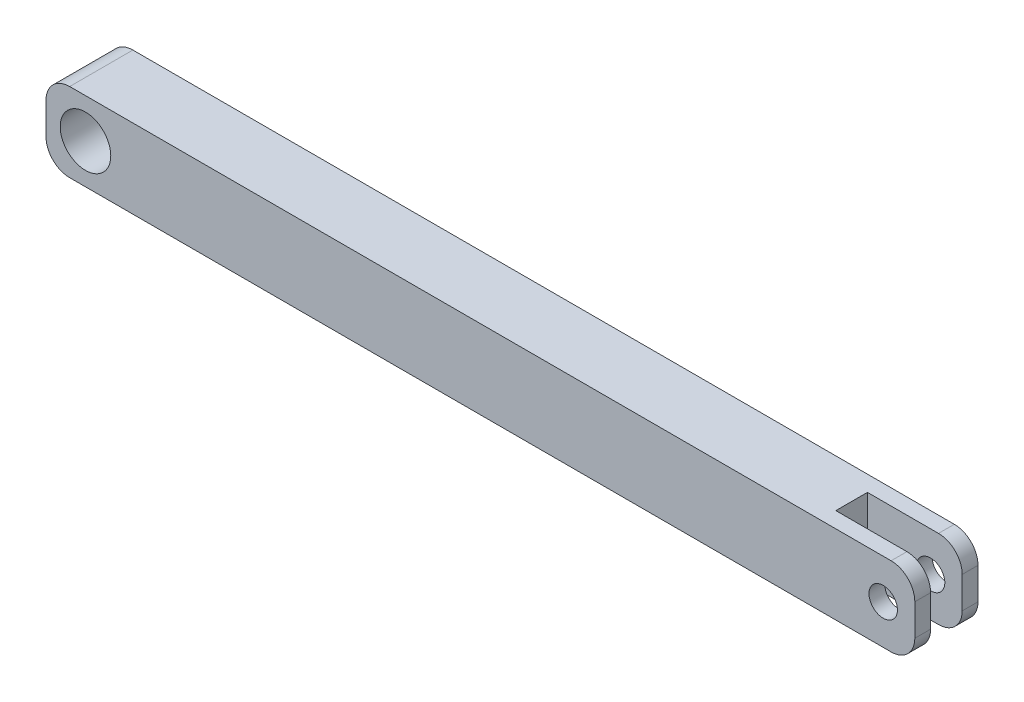
from build123d import *

# Parameters (mm, degrees)
SKETCH_5_W          = 55
SKETCH_5_H          = 3
EXTRUDE_1_DEPTH     = 5
CUT_EXTRUDE_1_REACH = 57.308
SKETCH_6_R          = 1.6
CUT_EXTRUDE_2_REACH = 57.308
SKETCH_7_R          = 0.9
FILLET_1_R          = 1.5
SKETCH_8_W          = 6
SKETCH_8_H          = 1.6
CUT_EXTRUDE_3_DEPTH = 10
SKETCH_10_R         = 1.6
SKETCH_10_R_2       = 0.9
EXTRUDE_2_DEPTH     = 0.5
EXTRUDE_START       = 0.5
SKETCH_11_R         = 0.9
SKETCH_11_R_2       = 1.6
EXTRUDE_3_DEPTH     = 0.5
SKETCH_12_W         = 6.070611882
SKETCH_12_H         = 2
CUT_EXTRUDE_4_DEPTH = 10


with BuildPart() as part:
    # 草图5 → 凸台-拉伸1 (new body)
    with BuildSketch(Plane(origin=(0, 0, 0), x_dir=(1, 0, 0), z_dir=(0, 1, 0))):
        with Locations((27.5, -1.5)):
            Rectangle(SKETCH_5_W, SKETCH_5_H)
    extrude(amount=EXTRUDE_1_DEPTH)

    # 草图6 → 切除-拉伸1 (cut, up to next)
    with BuildSketch(Plane.XY.offset(3), mode=Mode.PRIVATE) as cut_extrude_1_sk1:
        with Locations((2.5, 2.5)):
            Circle(SKETCH_6_R)
    cut_extrude_1_tool1 = extrude(cut_extrude_1_sk1.sketch, amount=-CUT_EXTRUDE_1_REACH, mode=Mode.PRIVATE) & part.part
    add(cut_extrude_1_tool1.solids().sort_by_distance((2.5, 2.5, 3))[0], mode=Mode.SUBTRACT)

    # 草图7 → 切除-拉伸2 (cut, up to next)
    with BuildSketch(Plane.XY, mode=Mode.PRIVATE) as cut_extrude_2_sk1:
        with Locations(Location((53, 2.5, 0), (0, 0, 180))):
            Circle(SKETCH_7_R)
    cut_extrude_2_tool1 = extrude(cut_extrude_2_sk1.sketch, amount=CUT_EXTRUDE_2_REACH, mode=Mode.PRIVATE) & part.part
    add(cut_extrude_2_tool1.solids().sort_by_distance((53, 2.5, 0))[0], mode=Mode.SUBTRACT)

    # 圆角1
    fillet_1_edges = [part.edges().sort_by_distance(p)[0] for p in [
        (55, 5, 1.5),
        (55, 0, 1.5),
        (0, 0, 1.5),
        (0, 5, 1.5),
    ]]
    fillet(fillet_1_edges, radius=FILLET_1_R)

    # 草图8 → 切除-拉伸3 (cut)
    with BuildSketch(Plane(origin=(0, 5, 0), x_dir=(1, 0, 0), z_dir=(0, 1, 0))):
        with Locations((52, -1.5)):
            Rectangle(SKETCH_8_W, SKETCH_8_H)
    extrude(amount=-CUT_EXTRUDE_3_DEPTH, mode=Mode.SUBTRACT)

    # 草图10 → 凸台-拉伸2 (add)
    with BuildSketch(Plane.XY.offset(3)):
        with BuildLine():
            Line((55, 1.5), (55, 3.5))
            ThreePointArc((55, 3.5), (54.560660172, 4.560660172), (53.5, 5))
            Line((53.5, 5), (1.5, 5))
            ThreePointArc((1.5, 5), (0.439339828, 4.560660172), (0, 3.5))
            Line((0, 3.5), (0, 1.5))
            ThreePointArc((0, 1.5), (0.439339828, 0.439339828), (1.5, 0))
            Line((1.5, 0), (53.5, 0))
            ThreePointArc((53.5, 0), (54.560660172, 0.439339828), (55, 1.5))
        make_face()
        with Locations((2.5, 2.5)):
            Circle(SKETCH_10_R, mode=Mode.SUBTRACT)
        with Locations((53, 2.5)):
            Circle(SKETCH_10_R_2, mode=Mode.SUBTRACT)
    extrude(amount=EXTRUDE_2_DEPTH)

    # 草图11 → 凸台-拉伸3 (add)
    with BuildSketch(Plane(origin=(0, 0, 0), x_dir=(-1, 0, 0), z_dir=(0, 0, -1)).offset(EXTRUDE_START)):
        with BuildLine():
            Line((-1.5, 5), (-53.5, 5))
            ThreePointArc((-53.5, 5), (-54.560660172, 4.560660172), (-55, 3.5))
            Line((-55, 3.5), (-55, 1.5))
            ThreePointArc((-55, 1.5), (-54.560660172, 0.439339828), (-53.5, 0))
            Line((-53.5, 0), (-1.5, 0))
            ThreePointArc((-1.5, 0), (-0.439339828, 0.439339828), (0, 1.5))
            Line((0, 1.5), (0, 3.5))
            ThreePointArc((0, 3.5), (-0.439339828, 4.560660172), (-1.5, 5))
        make_face()
        with Locations(Location((-53, 2.5, 0), (0, 0, 180))):
            Circle(SKETCH_11_R, mode=Mode.SUBTRACT)
        with Locations(Location((-2.5, 2.5, 0), (0, 0, 180))):
            Circle(SKETCH_11_R_2, mode=Mode.SUBTRACT)
    extrude(amount=-EXTRUDE_3_DEPTH)

    # 草图12 → 切除-拉伸4 (cut)
    with BuildSketch(Plane.XZ):
        with Locations((52.035305941, 1.5)):
            Rectangle(SKETCH_12_W, SKETCH_12_H)
    extrude(amount=-CUT_EXTRUDE_4_DEPTH, mode=Mode.SUBTRACT)


solid = part.part
